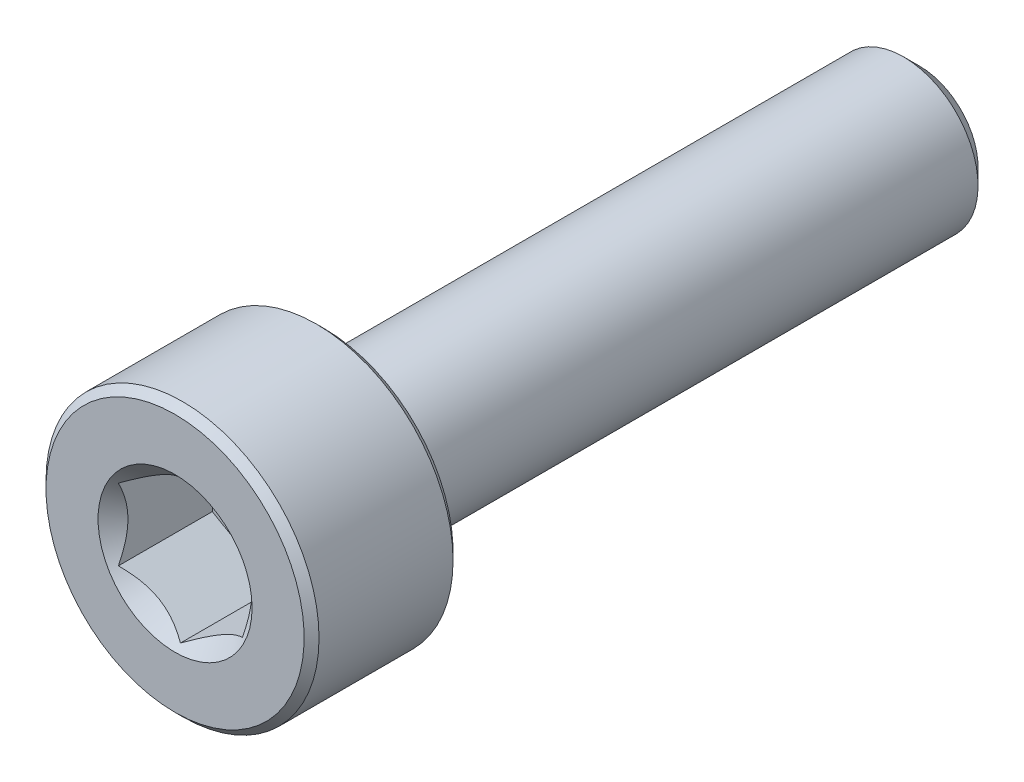
from build123d import *

# Parameters (mm, degrees)
CUT_EXTRUDE1_DEPTH = 2
SKETCH4_R          = 1.551628848
CUT_EXTRUDE2_DEPTH = 1.5
CUT_EXTRUDE2_DRAFT = -45


with BuildPart() as part:
    # Sketch2 → Revolve1 (revolve)
    with BuildSketch(Plane(origin=(0, 0, 0), x_dir=(0, 0, -1), z_dir=(1, 0, 0))):
        with BuildLine():
            Line((-7.5, 0), (-7.5, 2.6))
            Line((-7.5, 2.6), (-7.35, 2.75))
            Line((-7.35, 2.75), (-4.65, 2.75))
            Line((-4.65, 2.75), (-4.5, 2.6))
            Line((-4.5, 2.6), (-4.5, 1.65))
            ThreePointArc((-4.5, 1.65), (-4.456066017, 1.543933983), (-4.35, 1.5))
            Line((-4.35, 1.5), (7.175240474, 1.5))
            Line((7.175240474, 1.5), (7.5, 1.175240474))
            Line((7.5, 1.175240474), (7.5, 0))
            Line((7.5, 0), (-7.5, 0))
        make_face()
    revolve(axis=Axis((0, 0, -7.5), (0, 0, 1)))

    # Sketch3 → Cut-Extrude1 (cut)
    with BuildSketch(Plane.XY.offset(7.5)):
        Polygon((1.25, -0.721687836), (1.25, 0.721687836), (0, 1.443375673), (-1.25, 0.721687836), (-1.25, -0.721687836), (0, -1.443375673), align=None)
    extrude(amount=-CUT_EXTRUDE1_DEPTH, mode=Mode.SUBTRACT)


with BuildPart() as cut_extrude2_tool:
    # Sketch4 → Cut-Extrude2 (with draft: the straight prism first)
    with BuildSketch(Plane.XY.offset(7.5)):
        Circle(SKETCH4_R)
    extrude(amount=-CUT_EXTRUDE2_DEPTH)
    # Cut-Extrude2: the draft: its side faces are tilted about the plane it starts from
    cut_extrude2_sides = [cut_extrude2_tool.faces().sort_by_distance(p)[0] for p in [
        (-1.551628848, 0, 6.75),
    ]]
    draft(cut_extrude2_sides, Plane.XY.offset(7.5), CUT_EXTRUDE2_DRAFT)


with BuildPart() as part_1:
    add(part.part)

    # Cut-Extrude2: cut by cut_extrude2_tool
    add(cut_extrude2_tool.part, mode=Mode.SUBTRACT)


solid = part_1.part
